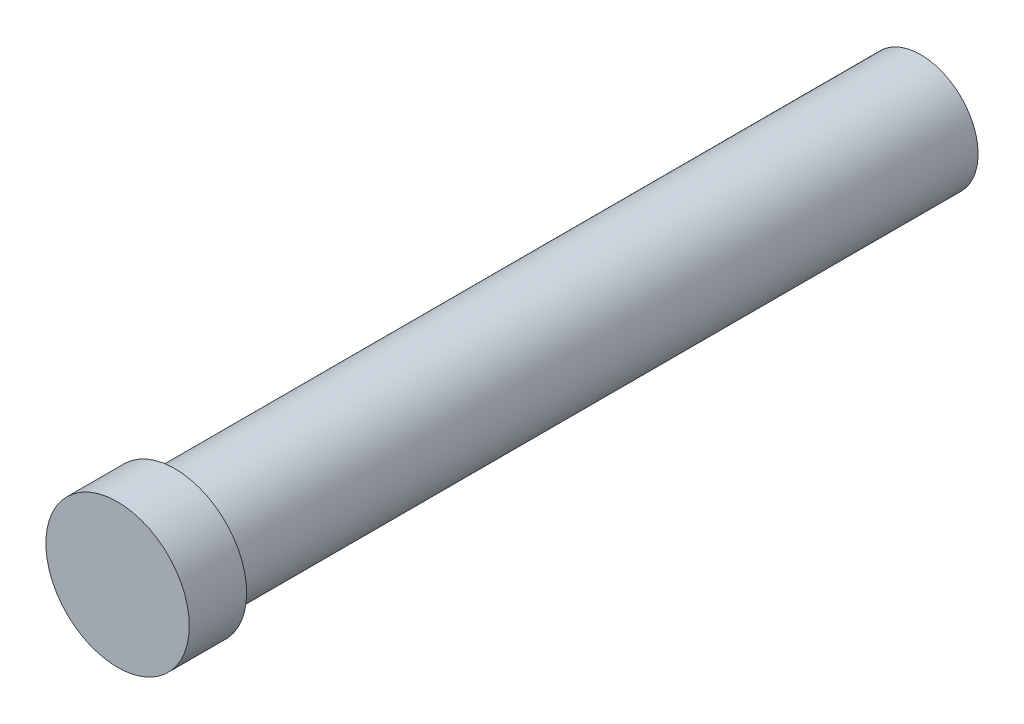
from build123d import *

# Parameters (mm, degrees)
SKETCH1_R           = 1
BOSS_EXTRUDE1_DEPTH = 13
SKETCH2_R           = 1.25
BOSS_EXTRUDE2_DEPTH = 1


with BuildPart() as part:
    # Sketch1 → Boss-Extrude1 (new body)
    with BuildSketch(Plane.XY):
        with Locations(Location((0, 0, 0), (0, 0, 180))):
            Circle(SKETCH1_R)
    extrude(amount=BOSS_EXTRUDE1_DEPTH)

    # Sketch2 → Boss-Extrude2 (add)
    with BuildSketch(Plane.XY.offset(13)):
        Circle(SKETCH2_R)
    extrude(amount=BOSS_EXTRUDE2_DEPTH)


solid = part.part
